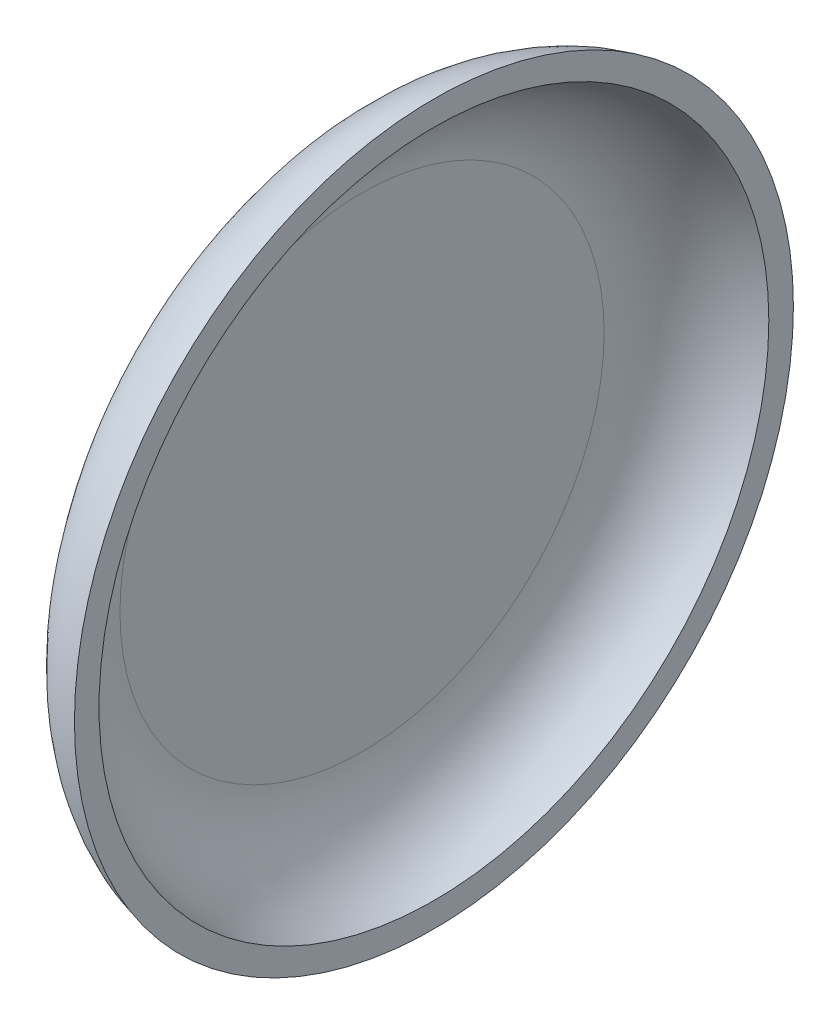
from build123d import *


with BuildPart() as part:
    # Çizim1 → Döndür1 (revolve)
    with BuildSketch(Plane.XY, mode=Mode.PRIVATE) as d_nd_r1_sk:
        with BuildLine():
            Line((-4, 0), (-4, 10.101020514))
            ThreePointArc((-4, 10.101020514), (-2.872983346, 13.263298175), (0, 15))
            Line((0, 15), (0, 13.974003861))
            ThreePointArc((0, 13.974003861), (-2.16227766, 12.550510257), (-3, 10.101020514))
            Line((-3, 10.101020514), (-3, 0))
            Line((-3, 0), (-4, 0))
        make_face()
    revolve(d_nd_r1_sk.sketch.rotate(Axis((0, 0, 0), (-1, 0, 0)), 90), axis=Axis((0, 0, 0), (-1, 0, 0)))


solid = part.part
